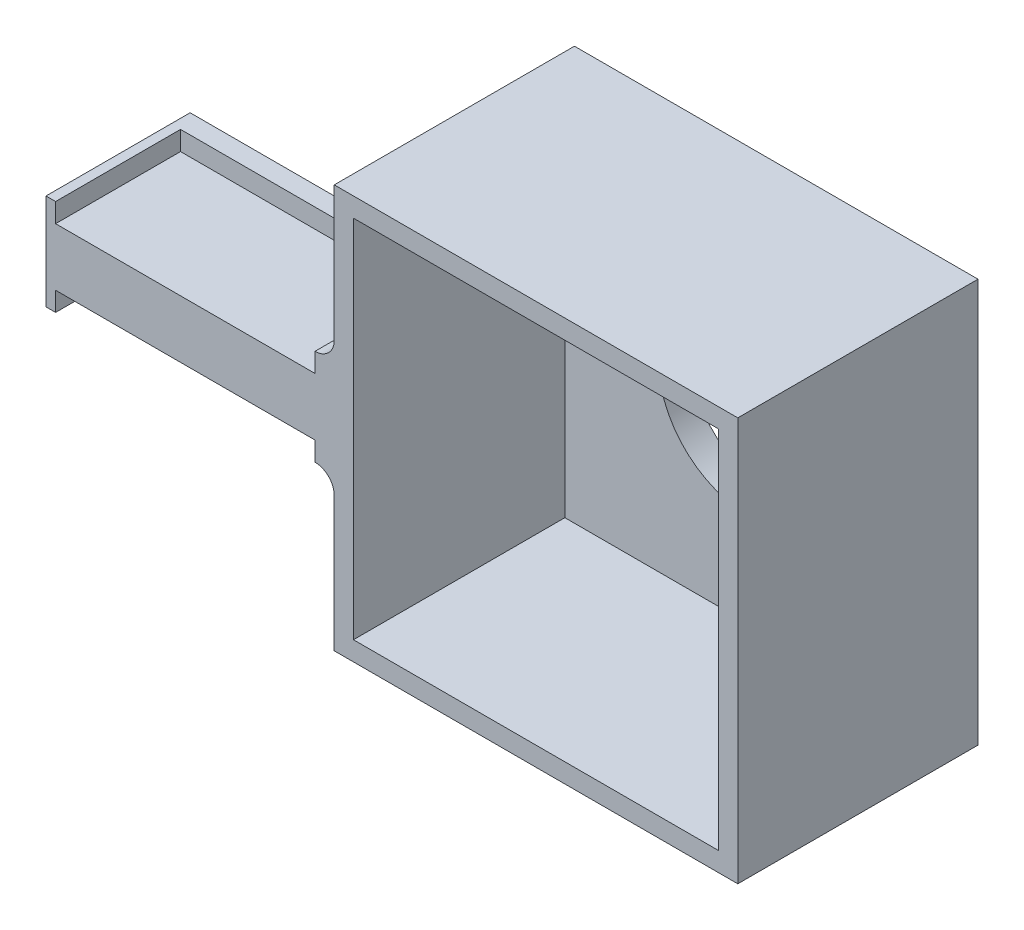
from build123d import *

# Parameters (mm, degrees)
SKETCH_1_W          = 42
SKETCH_1_H          = 42
EXTRUDE_1_DEPTH     = 25
SKETCH_2_W          = 38
SKETCH_2_H          = 38
CUT_EXTRUDE_1_DEPTH = 22
SKETCH_3_R          = 9.25
CUT_EXTRUDE_2_DEPTH = 65.443773943
SKETCH_4_W          = 15
SKETCH_4_H          = 10
EXTRUDE_2_DEPTH     = 30
SKETCH_5_W          = 27
SKETCH_5_H          = 12
CUT_EXTRUDE_3_DEPTH = 2
SKETCH_6_W          = 27
SKETCH_6_H          = 13
CUT_EXTRUDE_4_DEPTH = 2
FILLET_1_R          = 2


with BuildPart() as part:
    # 스케치1 → 보스-돌출1 (new body)
    with BuildSketch(Plane.XY):
        with Locations((21, -21)):
            Rectangle(SKETCH_1_W, SKETCH_1_H)
    extrude(amount=EXTRUDE_1_DEPTH)

    # 스케치2 → 컷-돌출1 (cut)
    with BuildSketch(Plane.XY.offset(25)):
        with Locations((21, -21)):
            Rectangle(SKETCH_2_W, SKETCH_2_H)
    extrude(amount=-CUT_EXTRUDE_1_DEPTH, mode=Mode.SUBTRACT)

    # 스케치3 → 컷-돌출2 (cut, through all)
    with BuildSketch(Plane(origin=(0, 0, 0), x_dir=(-1, 0, 0), z_dir=(0, 0, -1))):
        with Locations((-21, -21)):
            Circle(SKETCH_3_R)
    extrude(amount=-CUT_EXTRUDE_2_DEPTH, mode=Mode.SUBTRACT)

    # 스케치4 → 보스-돌출2 (add)
    with BuildSketch(Plane.ZY):
        with Locations((17.5, -21)):
            Rectangle(SKETCH_4_W, SKETCH_4_H)
    extrude(amount=EXTRUDE_2_DEPTH)

    # 스케치5 → 컷-돌출3 (cut)
    with BuildSketch(Plane.XZ.offset(26)):
        with Locations((-15.5, 19)):
            Rectangle(SKETCH_5_W, SKETCH_5_H)
    extrude(amount=-CUT_EXTRUDE_3_DEPTH, mode=Mode.SUBTRACT)

    # 스케치6 → 컷-돌출4 (cut)
    with BuildSketch(Plane(origin=(0, -16, 0), x_dir=(1, 0, 0), z_dir=(0, 1, 0))):
        with Locations((-15.5, -18.5)):
            Rectangle(SKETCH_6_W, SKETCH_6_H)
    extrude(amount=-CUT_EXTRUDE_4_DEPTH, mode=Mode.SUBTRACT)

    # 필렛1
    fillet_1_edges = [part.edges().sort_by_distance(p)[0] for p in [
        (0, -26, 17.5),
        (0, -16, 17.5),
    ]]
    fillet(fillet_1_edges, radius=FILLET_1_R)


solid = part.part
